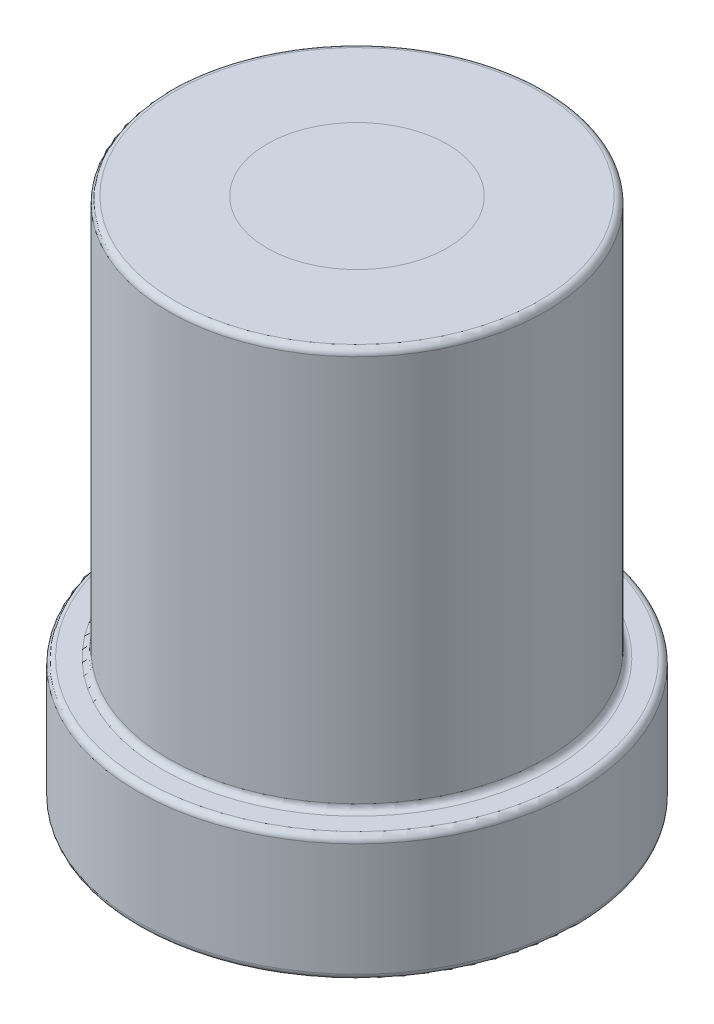
from build123d import *

# Parameters (mm, degrees)
SKETCH1_R           = 7
BOSS_EXTRUDE1_DEPTH = 4
SKETCH2_R           = 6
BOSS_EXTRUDE2_DEPTH = 12.75
SKETCH3_R           = 2.875
CUT_EXTRUDE1_DEPTH  = 20.456682657
SKETCH4_R           = 4.4
CUT_EXTRUDE2_DEPTH  = 3
CHAMFER1_SIZE       = 1.3
CHAMFER1_SIZE2      = 0.5
SKETCH5_R           = 4.4
BOSS_EXTRUDE3_DEPTH = 2
DOME1_FACE_RADIUS   = 4.4
DOME1_HEIGHT        = 0.5
FILLET1_R           = 0.2
SKETCH6_R           = 2.875
BOSS_EXTRUDE4_DEPTH = 2


with BuildPart() as part:
    # Sketch1 → Boss-Extrude1 (new body)
    with BuildSketch(Plane(origin=(0, 0, 0), x_dir=(1, 0, 0), z_dir=(0, 1, 0))):
        with Locations(Location((0, 0, 0), (0, 0, 270))):
            Circle(SKETCH1_R)
    extrude(amount=BOSS_EXTRUDE1_DEPTH)

    # Sketch2 → Boss-Extrude2 (add)
    with BuildSketch(Plane(origin=(0, 4, 0), x_dir=(1, 0, 0), z_dir=(0, 1, 0))):
        with Locations(Location((0, 0, 0), (0, 0, 270))):
            Circle(SKETCH2_R)
    extrude(amount=BOSS_EXTRUDE2_DEPTH)

    # Sketch3 → Cut-Extrude1 (cut, through all)
    with BuildSketch(Plane(origin=(0, 16.75, 0), x_dir=(1, 0, 0), z_dir=(0, 1, 0))):
        with Locations(Location((0, 0, 0), (0, 0, 270))):
            Circle(SKETCH3_R)
    extrude(amount=-CUT_EXTRUDE1_DEPTH, mode=Mode.SUBTRACT)

    # Sketch4 → Cut-Extrude2 (cut)
    with BuildSketch(Plane(origin=(0, 0, 0), x_dir=(-1, 0, 0), z_dir=(0, -1, 0))):
        with Locations(Location((0, 0, 0), (0, 0, 90))):
            Circle(SKETCH4_R)
    extrude(amount=-CUT_EXTRUDE2_DEPTH, mode=Mode.SUBTRACT)

    # Chamfer1
    chamfer1_edges = [part.edges().sort_by_distance(p)[0] for p in [
        (0, 0, 4.4),
    ]]
    chamfer1_side = [part.faces().sort_by_distance(p)[0] for p in [
        (0, 0, -6.802010101),
    ]]
    chamfer(chamfer1_edges, length=CHAMFER1_SIZE, length2=CHAMFER1_SIZE2, reference=chamfer1_side[0])

    # Fillet1
    fillet1_edges = [part.edges().sort_by_distance(p)[0] for p in [
        (0, 0, -7),
        (0, 0.5, 4.4),
        (0, 0, 5.7),
        (0, 4, -7),
        (0, 4, -6),
        (0, 16.75, -6),
    ]]
    fillet(fillet1_edges, radius=FILLET1_R)


with BuildPart() as body_2:
    # Sketch5 → Boss-Extrude3 (new body)
    with BuildSketch(Plane(origin=(0, 3, 0), x_dir=(-1, 0, 0), z_dir=(0, -1, 0))):
        with Locations(Location((0, 0, 0), (0, 0, 90))):
            Circle(SKETCH5_R)
    extrude(amount=BOSS_EXTRUDE3_DEPTH)

    # Dome1: a dome of height H over a round flat face of radius A is a cap of a sphere of radius (A * A + H * H) / (2 * H)
    dome1_r = (DOME1_FACE_RADIUS * DOME1_FACE_RADIUS + DOME1_HEIGHT * DOME1_HEIGHT) / (2 * DOME1_HEIGHT)
    dome1_base = Plane((0, 1, 0), z_dir=(0, -1, 0))
    with Locations(dome1_base.offset(DOME1_HEIGHT - dome1_r)):
        dome1_ball = Sphere(dome1_r, mode=Mode.PRIVATE)
    add(split(dome1_ball, bisect_by=dome1_base, keep=Keep.TOP, mode=Mode.PRIVATE))


with BuildPart() as body_3:
    # Sketch6 → Boss-Extrude4 (new body)
    with BuildSketch(Plane(origin=(0, 16.75, 0), x_dir=(1, 0, 0), z_dir=(0, 1, 0))):
        with Locations(Location((0, 0, 0), (0, 0, 270))):
            Circle(SKETCH6_R)
    extrude(amount=-BOSS_EXTRUDE4_DEPTH)


solid = Compound([part.part, body_2.part, body_3.part])
